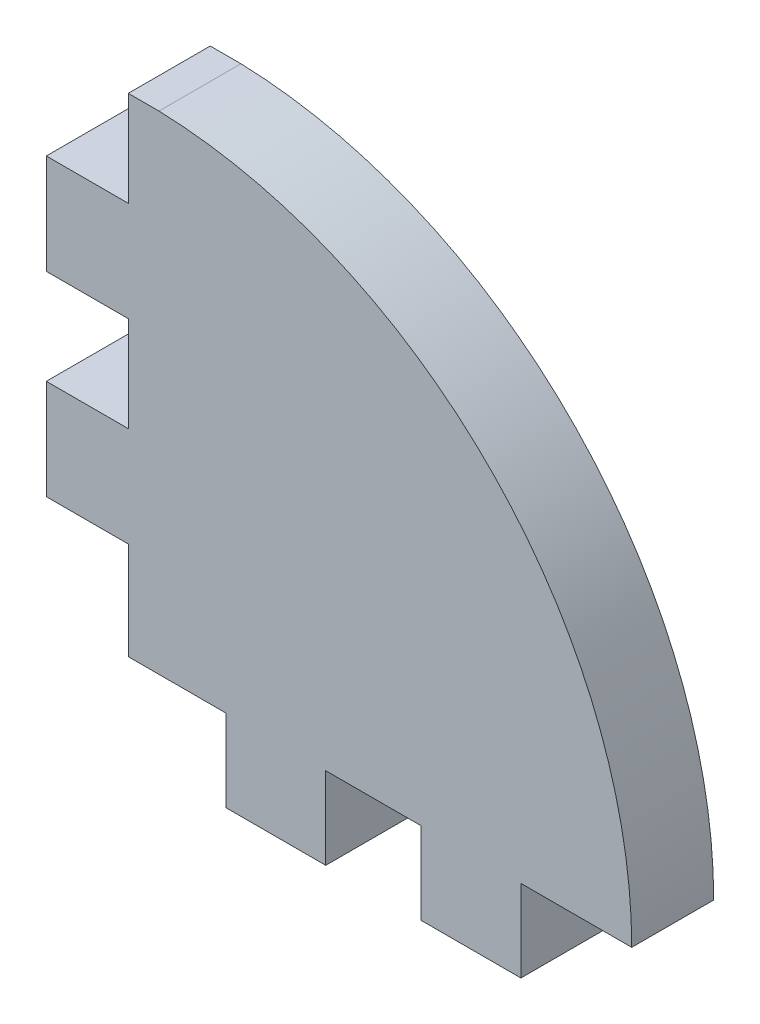
from build123d import *

# Parameters (mm, degrees)
BOSS_EXTRUDE1_DEPTH = 5.334
SKETCH2_W           = 5.334
SKETCH2_H           = 6.1976
SKETCH2_W_2         = 6.1976
SKETCH2_H_2         = 5.334
SKETCH2_W_3         = 7.2136
CUT_EXTRUDE1_DEPTH  = 50.881099186


with BuildPart() as part:
    # Sketch1 → Boss-Extrude1 (new body)
    with BuildSketch(Plane.XY):
        with BuildLine():
            Line((0, 31.75), (0, -5.334))
            Line((0, -5.334), (38.1, -5.334))
            Line((38.1, -5.334), (38.1, 0))
            ThreePointArc((38.1, 0), (29.146926861, 22.105308914), (7.334496124, 31.75))
            Line((7.334496124, 31.75), (5.334, 31.75))
            Line((5.334, 31.75), (0, 31.75))
        make_face()
    extrude(amount=-BOSS_EXTRUDE1_DEPTH)

    # Sketch2 → Cut-Extrude1 (cut, through all)
    with BuildSketch(Plane.XY):
        Polygon((11.684, -5.334), (11.684, 0), (5.334, 0), (5.334, 0.1524), (5.334, 6.35), (0, 6.35), (0, -5.334), align=None)
        with Locations((2.667, 28.6512)):
            Rectangle(SKETCH2_W, SKETCH2_H)
        with Locations((2.667, 15.9512)):
            Rectangle(SKETCH2_W, SKETCH2_H)
        with Locations((21.2852, -2.667)):
            Rectangle(SKETCH2_W_2, SKETCH2_H_2)
        with Locations((34.4932, -2.667)):
            Rectangle(SKETCH2_W_3, SKETCH2_H_2)
    extrude(amount=-CUT_EXTRUDE1_DEPTH, mode=Mode.SUBTRACT)


solid = part.part
